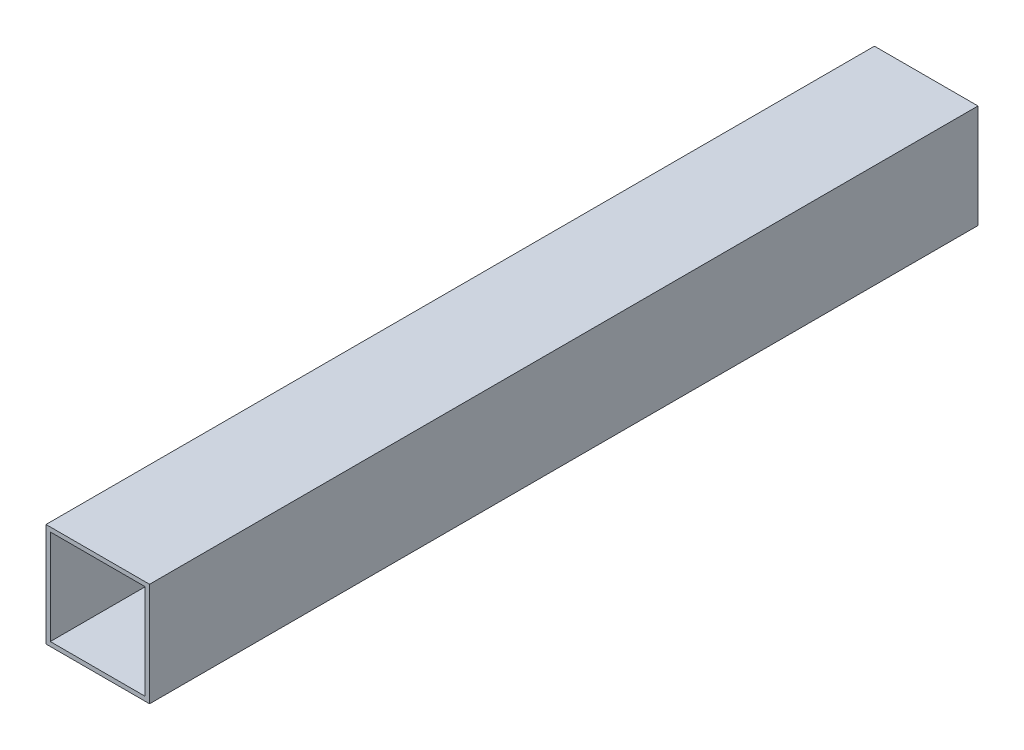
from build123d import *

# Parameters (mm, degrees)
SKETCH2_W           = 38.1
SKETCH2_H           = 38.1
SKETCH2_W_2         = 34.925
SKETCH2_H_2         = 34.925
BOSS_EXTRUDE1_DEPTH = 304.8


with BuildPart() as part:
    # Sketch2 → Boss-Extrude1 (new body)
    with BuildSketch(Plane.XY):
        with Locations((19.05, 19.05)):
            Rectangle(SKETCH2_W, SKETCH2_H)
        with Locations((19.05, 19.05)):
            Rectangle(SKETCH2_W_2, SKETCH2_H_2, mode=Mode.SUBTRACT)
    extrude(amount=BOSS_EXTRUDE1_DEPTH)


solid = part.part
